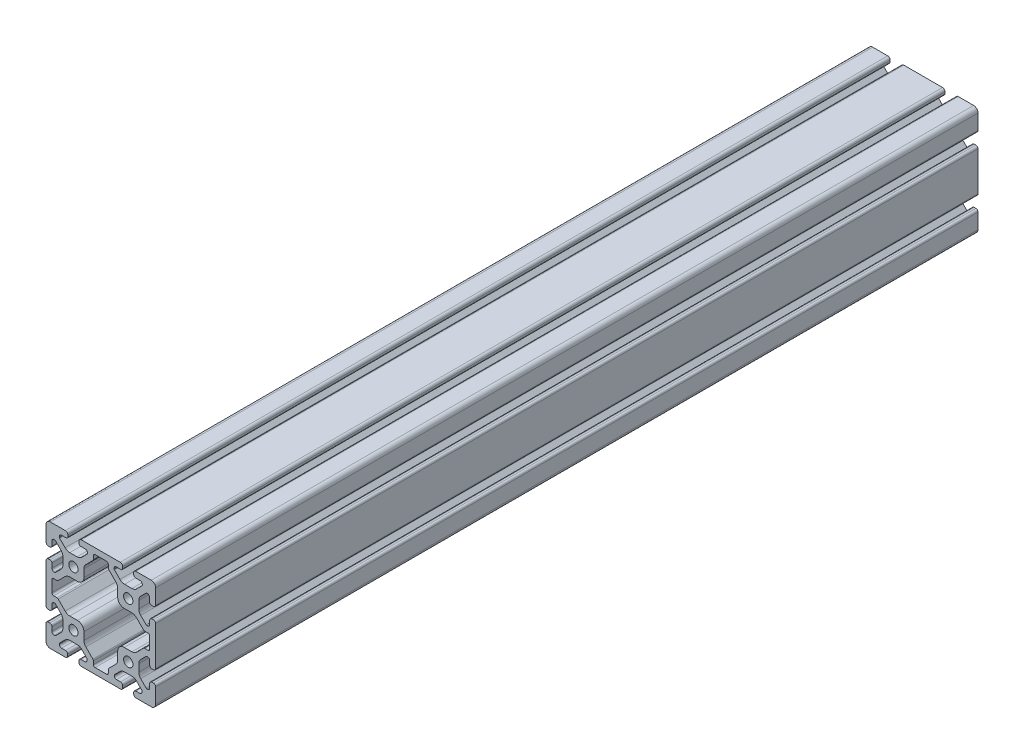
from build123d import *

# Parameters (mm, degrees)
SKETCH1_R                  = 3.4
EXTRUDE1_DEPTH             = 600
M8X1_25_TAPPED_HOLE4_D     = 6.8
M8X1_25_TAPPED_HOLE4_DEPTH = 9.75
M8X1_25_TAPPED_HOLE4_TIP   = 2.042926105
M8X1_25_TAPPED_HOLE3_D     = 6.8
M8X1_25_TAPPED_HOLE3_DEPTH = 31.65
M8X1_25_TAPPED_HOLE3_TIP   = 2.042926105


with BuildPart() as part:
    # Sketch1 → Extrude1 (new body)
    with BuildSketch(Plane.XY):
        with BuildLine():
            Line((29.091242789, 26.036541495), (33.082657296, 30.027956002))
            ThreePointArc((33.082657296, 30.027956002), (33.329219041, 30.192703293), (33.62005845, 30.250554848))
            Line((33.62005845, 30.250554848), (33.955571436, 30.250554848))
            ThreePointArc((33.955571436, 30.250554848), (35.065729082, 29.790712494), (35.525571436, 28.680554848))
            Line((35.525571436, 28.680554848), (35.525571436, 25.777866899))
            ThreePointArc((35.525571436, 25.777866899), (35.985413789, 24.667709253), (37.095571436, 24.207866899))
            Line((37.095571436, 24.207866899), (38.43, 24.207866899))
            ThreePointArc((38.43, 24.207866899), (39.540157646, 24.667709253), (40, 25.777866899))
            Line((40, 25.777866899), (40, 32.933852749))
            Line((40, 32.933852749), (40, 36.83))
            ThreePointArc((40, 36.83), (39.071528496, 39.071528496), (36.83, 40))
            Line((36.83, 40), (25.540851266, 40))
            ThreePointArc((25.540851266, 40), (24.43069362, 39.540157646), (23.970851266, 38.43))
            Line((23.970851266, 38.43), (23.970851266, 37.249043598))
            ThreePointArc((23.970851266, 37.249043598), (24.43069362, 36.138885952), (25.540851266, 35.679043598))
            Line((25.540851266, 35.679043598), (28.625762638, 35.679043598))
            ThreePointArc((28.625762638, 35.679043598), (29.77116849, 35.239363487), (30.250554848, 34.11))
            Line((30.250554848, 34.11), (30.250554848, 33.62005845))
            ThreePointArc((30.250554848, 33.62005845), (30.192703293, 33.329219041), (30.027956002, 33.082657296))
            Line((30.027956002, 33.082657296), (26.036541495, 29.091242789))
            ThreePointArc((26.036541495, 29.091242789), (24.495530588, 28.061572221), (22.677784284, 27.7))
            Line((22.677784284, 27.7), (17.322215716, 27.7))
            ThreePointArc((17.322215716, 27.7), (15.504469412, 28.061572221), (13.963458505, 29.091242789))
            Line((13.963458505, 29.091242789), (9.90393336, 33.150767934))
            ThreePointArc((9.90393336, 33.150767934), (9.764102181, 33.360040084), (9.715, 33.606893415))
            Line((9.715, 33.606893415), (9.715, 34.096834965))
            ThreePointArc((9.715, 34.096834965), (10.178698303, 35.216301697), (11.298165035, 35.68))
            Line((11.298165035, 35.68), (14.642754087, 35.68))
            ThreePointArc((14.642754087, 35.68), (15.560045469, 36.059954531), (15.94, 36.977245913))
            Line((15.94, 36.977245913), (15.94, 38.194841282))
            ThreePointArc((15.94, 38.194841282), (15.411281253, 39.471281253), (14.134841282, 40))
            Line((14.134841282, 40), (6.984433948, 40))
            Line((6.984433948, 40), (-6.984433948, 40))
            Line((-6.984433948, 40), (-14.134841282, 40))
            ThreePointArc((-14.134841282, 40), (-15.411281253, 39.471281253), (-15.94, 38.194841282))
            Line((-15.94, 38.194841282), (-15.94, 36.977245913))
            ThreePointArc((-15.94, 36.977245913), (-15.560045469, 36.059954531), (-14.642754087, 35.68))
            Line((-14.642754087, 35.68), (-11.298165035, 35.68))
            ThreePointArc((-11.298165035, 35.68), (-10.178698303, 35.216301697), (-9.715, 34.096834965))
            Line((-9.715, 34.096834965), (-9.715, 33.606893415))
            ThreePointArc((-9.715, 33.606893415), (-9.764102181, 33.360040084), (-9.90393336, 33.150767934))
            Line((-9.90393336, 33.150767934), (-13.963458505, 29.091242789))
            ThreePointArc((-13.963458505, 29.091242789), (-15.504469412, 28.061572221), (-17.322215716, 27.7))
            Line((-17.322215716, 27.7), (-22.677784284, 27.7))
            ThreePointArc((-22.677784284, 27.7), (-24.495530588, 28.061572221), (-26.036541495, 29.091242789))
            Line((-26.036541495, 29.091242789), (-30.09606664, 33.150767934))
            ThreePointArc((-30.09606664, 33.150767934), (-30.235897819, 33.360040084), (-30.285, 33.606893415))
            Line((-30.285, 33.606893415), (-30.285, 34.096834965))
            ThreePointArc((-30.285, 34.096834965), (-29.821301697, 35.216301697), (-28.701834965, 35.68))
            Line((-28.701834965, 35.68), (-25.357245913, 35.68))
            ThreePointArc((-25.357245913, 35.68), (-24.439954531, 36.059954531), (-24.06, 36.977245913))
            Line((-24.06, 36.977245913), (-24.06, 38.194841282))
            ThreePointArc((-24.06, 38.194841282), (-24.588718747, 39.471281253), (-25.865158718, 40))
            Line((-25.865158718, 40), (-33.031395847, 40))
            Line((-33.031395847, 40), (-36.83, 40))
            ThreePointArc((-36.83, 40), (-39.071528496, 39.071528496), (-40, 36.83))
            Line((-40, 36.83), (-40, 33.318079463))
            Line((-40, 33.318079463), (-40, 25.865158718))
            ThreePointArc((-40, 25.865158718), (-39.471281253, 24.588718747), (-38.194841282, 24.06))
            Line((-38.194841282, 24.06), (-36.977245913, 24.06))
            ThreePointArc((-36.977245913, 24.06), (-36.059954531, 24.439954531), (-35.68, 25.357245913))
            Line((-35.68, 25.357245913), (-35.68, 28.680554848))
            ThreePointArc((-35.68, 28.680554848), (-35.220157646, 29.790712494), (-34.11, 30.250554848))
            Line((-34.11, 30.250554848), (-33.62005845, 30.250554848))
            ThreePointArc((-33.62005845, 30.250554848), (-33.329219041, 30.192703293), (-33.082657296, 30.027956002))
            Line((-33.082657296, 30.027956002), (-29.091242789, 26.036541495))
            ThreePointArc((-29.091242789, 26.036541495), (-28.061572221, 24.495530588), (-27.7, 22.677784284))
            Line((-27.7, 22.677784284), (-27.7, 17.322215716))
            ThreePointArc((-27.7, 17.322215716), (-28.061572221, 15.504469412), (-29.091242789, 13.963458505))
            Line((-29.091242789, 13.963458505), (-33.082657296, 9.972043998))
            ThreePointArc((-33.082657296, 9.972043998), (-33.329219041, 9.807296707), (-33.62005845, 9.749445152))
            Line((-33.62005845, 9.749445152), (-34.11, 9.749445152))
            ThreePointArc((-34.11, 9.749445152), (-35.220157646, 10.209287506), (-35.68, 11.319445152))
            Line((-35.68, 11.319445152), (-35.68, 14.642754087))
            ThreePointArc((-35.68, 14.642754087), (-36.059954531, 15.560045469), (-36.977245913, 15.94))
            Line((-36.977245913, 15.94), (-38.194841282, 15.94))
            ThreePointArc((-38.194841282, 15.94), (-39.471281253, 15.411281253), (-40, 14.134841282))
            Line((-40, 14.134841282), (-40, 7.016888977))
            Line((-40, 7.016888977), (-40, -7.016888977))
            Line((-40, -7.016888977), (-40, -14.447338303))
            ThreePointArc((-40, -14.447338303), (-39.540157646, -15.557495949), (-38.43, -16.017338303))
            Line((-38.43, -16.017338303), (-37.25, -16.017338303))
            ThreePointArc((-37.25, -16.017338303), (-36.139842354, -15.557495949), (-35.68, -14.447338303))
            Line((-35.68, -14.447338303), (-35.68, -11.319445152))
            ThreePointArc((-35.68, -11.319445152), (-35.220157646, -10.209287506), (-34.11, -9.749445152))
            Line((-34.11, -9.749445152), (-33.62005845, -9.749445152))
            ThreePointArc((-33.62005845, -9.749445152), (-33.329219041, -9.807296707), (-33.082657296, -9.972043998))
            Line((-33.082657296, -9.972043998), (-29.091242789, -13.963458505))
            ThreePointArc((-29.091242789, -13.963458505), (-28.061572221, -15.504469412), (-27.7, -17.322215716))
            Line((-27.7, -17.322215716), (-27.7, -22.677784284))
            ThreePointArc((-27.7, -22.677784284), (-28.061572221, -24.495530588), (-29.091242789, -26.036541495))
            Line((-29.091242789, -26.036541495), (-32.871776968, -29.817075674))
            ThreePointArc((-32.871776968, -29.817075674), (-33.10612883, -29.976640176), (-33.382654504, -30.039211548))
            Line((-33.382654504, -30.039211548), (-34.05520779, -30.062697627))
            ThreePointArc((-34.05520779, -30.062697627), (-35.200613642, -29.623017515), (-35.68, -28.493654028))
            Line((-35.68, -28.493654028), (-35.68, -25.59096608))
            ThreePointArc((-35.68, -25.59096608), (-36.139842354, -24.480808433), (-37.25, -24.02096608))
            Line((-37.25, -24.02096608), (-38.43, -24.02096608))
            ThreePointArc((-38.43, -24.02096608), (-39.540157646, -24.480808433), (-40, -25.59096608))
            Line((-40, -25.59096608), (-40, -33.019082273))
            Line((-40, -33.019082273), (-40, -36.83))
            ThreePointArc((-40, -36.83), (-39.071528496, -39.071528496), (-36.83, -40))
            Line((-36.83, -40), (-33, -40))
            Line((-33, -40), (-25.72307469, -40))
            ThreePointArc((-25.72307469, -40), (-24.612917043, -39.540157646), (-24.15307469, -38.43))
            Line((-24.15307469, -38.43), (-24.15307469, -37.25))
            ThreePointArc((-24.15307469, -37.25), (-24.612917043, -36.139842354), (-25.72307469, -35.68))
            Line((-25.72307469, -35.68), (-28.680554848, -35.68))
            ThreePointArc((-28.680554848, -35.68), (-29.790712494, -35.220157646), (-30.250554848, -34.11))
            Line((-30.250554848, -34.11), (-30.250554848, -33.62005845))
            ThreePointArc((-30.250554848, -33.62005845), (-30.192703293, -33.329219041), (-30.027956002, -33.082657296))
            Line((-30.027956002, -33.082657296), (-26.036541495, -29.091242789))
            ThreePointArc((-26.036541495, -29.091242789), (-24.495530588, -28.061572221), (-22.677784284, -27.7))
            Line((-22.677784284, -27.7), (-17.322215716, -27.7))
            ThreePointArc((-17.322215716, -27.7), (-15.504469412, -28.061572221), (-13.963458505, -29.091242789))
            Line((-13.963458505, -29.091242789), (-10.203784275, -32.85091702))
            ThreePointArc((-10.203784275, -32.85091702), (-10.044219772, -33.085268882), (-9.9816484, -33.361794556))
            Line((-9.9816484, -33.361794556), (-9.957433876, -34.05520779))
            ThreePointArc((-9.957433876, -34.05520779), (-10.397113988, -35.200613642), (-11.526477474, -35.68))
            Line((-11.526477474, -35.68), (-14.429165423, -35.68))
            ThreePointArc((-14.429165423, -35.68), (-15.539323069, -36.139842354), (-15.999165423, -37.25))
            Line((-15.999165423, -37.25), (-15.999165423, -38.43))
            ThreePointArc((-15.999165423, -38.43), (-15.539323069, -39.540157646), (-14.429165423, -40))
            Line((-14.429165423, -40), (-6.998716097, -40))
            Line((-6.998716097, -40), (6.998716097, -40))
            Line((6.998716097, -40), (14.424638994, -40))
            ThreePointArc((14.424638994, -40), (15.53479664, -39.540157646), (15.994638994, -38.43))
            Line((15.994638994, -38.43), (15.994638994, -37.032644306))
            ThreePointArc((15.994638994, -37.032644306), (15.53479664, -35.922486659), (14.424638994, -35.462644306))
            Line((14.424638994, -35.462644306), (11.382372282, -35.462644306))
            ThreePointArc((11.382372282, -35.462644306), (10.272214636, -35.002801952), (9.812372282, -33.892644306))
            Line((9.812372282, -33.892644306), (9.812372282, -33.55713132))
            ThreePointArc((9.812372282, -33.55713132), (9.870223837, -33.266291912), (10.034971128, -33.019730166))
            Line((10.034971128, -33.019730166), (13.963458505, -29.091242789))
            ThreePointArc((13.963458505, -29.091242789), (15.504469412, -28.061572221), (17.322215716, -27.7))
            Line((17.322215716, -27.7), (22.677784284, -27.7))
            ThreePointArc((22.677784284, -27.7), (24.495530588, -28.061572221), (26.036541495, -29.091242789))
            Line((26.036541495, -29.091242789), (29.794925243, -32.849626538))
            ThreePointArc((29.794925243, -32.849626538), (29.954489746, -33.083978399), (30.017061118, -33.360504074))
            Line((30.017061118, -33.360504074), (30.041320706, -34.05520779))
            ThreePointArc((30.041320706, -34.05520779), (29.601640594, -35.200613642), (28.472277108, -35.68))
            Line((28.472277108, -35.68), (25.569589159, -35.68))
            ThreePointArc((25.569589159, -35.68), (24.459431513, -36.139842354), (23.999589159, -37.25))
            Line((23.999589159, -37.25), (23.999589159, -38.43))
            ThreePointArc((23.999589159, -38.43), (24.459431513, -39.540157646), (25.569589159, -40))
            Line((25.569589159, -40), (32.999849358, -40))
            Line((32.999849358, -40), (36.83, -40))
            ThreePointArc((36.83, -40), (39.071528496, -39.071528496), (40, -36.83))
            Line((40, -36.83), (40, -33.025941835))
            Line((40, -33.025941835), (40, -25.777866899))
            ThreePointArc((40, -25.777866899), (39.540157646, -24.667709253), (38.43, -24.207866899))
            Line((38.43, -24.207866899), (37.25, -24.207866899))
            ThreePointArc((37.25, -24.207866899), (36.139842354, -24.667709253), (35.68, -25.777866899))
            Line((35.68, -25.777866899), (35.68, -28.680554848))
            ThreePointArc((35.68, -28.680554848), (35.220157646, -29.790712494), (34.11, -30.250554848))
            Line((34.11, -30.250554848), (33.62005845, -30.250554848))
            ThreePointArc((33.62005845, -30.250554848), (33.329219041, -30.192703293), (33.082657296, -30.027956002))
            Line((33.082657296, -30.027956002), (29.091242789, -26.036541495))
            ThreePointArc((29.091242789, -26.036541495), (28.061572221, -24.495530588), (27.7, -22.677784284))
            Line((27.7, -22.677784284), (27.7, -17.322215716))
            ThreePointArc((27.7, -17.322215716), (28.061572221, -15.504469412), (29.091242789, -13.963458505))
            Line((29.091242789, -13.963458505), (33.082657296, -9.972043998))
            ThreePointArc((33.082657296, -9.972043998), (33.329219041, -9.807296707), (33.62005845, -9.749445152))
            Line((33.62005845, -9.749445152), (34.11, -9.749445152))
            ThreePointArc((34.11, -9.749445152), (35.220157646, -10.209287506), (35.68, -11.319445152))
            Line((35.68, -11.319445152), (35.68, -14.222133101))
            ThreePointArc((35.68, -14.222133101), (36.139842354, -15.332290747), (37.25, -15.792133101))
            Line((37.25, -15.792133101), (38.43, -15.792133101))
            ThreePointArc((38.43, -15.792133101), (39.540157646, -15.332290747), (40, -14.222133101))
            Line((40, -14.222133101), (40, -7.021415406))
            Line((40, -7.021415406), (40, 7.021415406))
            Line((40, 7.021415406), (40, 14.222133101))
            ThreePointArc((40, 14.222133101), (39.540157646, 15.332290747), (38.43, 15.792133101))
            Line((38.43, 15.792133101), (37.25, 15.792133101))
            ThreePointArc((37.25, 15.792133101), (36.139842354, 15.332290747), (35.68, 14.222133101))
            Line((35.68, 14.222133101), (35.68, 11.319445152))
            ThreePointArc((35.68, 11.319445152), (35.220157646, 10.209287506), (34.11, 9.749445152))
            Line((34.11, 9.749445152), (33.62005845, 9.749445152))
            ThreePointArc((33.62005845, 9.749445152), (33.329219041, 9.807296707), (33.082657296, 9.972043998))
            Line((33.082657296, 9.972043998), (29.091242789, 13.963458505))
            ThreePointArc((29.091242789, 13.963458505), (28.061572221, 15.504469412), (27.7, 17.322215716))
            Line((27.7, 17.322215716), (27.7, 22.677784284))
            ThreePointArc((27.7, 22.677784284), (28.061572221, 24.495530588), (29.091242789, 26.036541495))
        make_face()
        with Locations((-20, 20)):
            Circle(SKETCH1_R, mode=Mode.SUBTRACT)
        with Locations((20, 20)):
            Circle(SKETCH1_R, mode=Mode.SUBTRACT)
        with Locations((20, -20)):
            Circle(SKETCH1_R, mode=Mode.SUBTRACT)
        with Locations((-20, -20)):
            Circle(SKETCH1_R, mode=Mode.SUBTRACT)
        with BuildLine():
            Line((17.07, 12.32), (22.657784284, 12.32))
            ThreePointArc((22.657784284, 12.32), (24.475530588, 11.958427779), (26.016541495, 10.928757211))
            Line((26.016541495, 10.928757211), (31.143879165, 5.80141954))
            ThreePointArc((31.143879165, 5.80141954), (31.555896818, 5.526118146), (32.041904777, 5.429445152))
            Line((32.041904777, 5.429445152), (34.41, 5.429445152))
            ThreePointArc((34.41, 5.429445152), (35.308025612, 5.057470764), (35.68, 4.159445152))
            Line((35.68, 4.159445152), (35.68, -4.159445152))
            ThreePointArc((35.68, -4.159445152), (35.308025612, -5.057470764), (34.41, -5.429445152))
            Line((34.41, -5.429445152), (32.041904777, -5.429445152))
            ThreePointArc((32.041904777, -5.429445152), (31.555896818, -5.526118146), (31.143879165, -5.80141954))
            Line((31.143879165, -5.80141954), (26.016541495, -10.928757211))
            ThreePointArc((26.016541495, -10.928757211), (24.475530588, -11.958427779), (22.657784284, -12.32))
            Line((22.657784284, -12.32), (17.07, -12.32))
            ThreePointArc((17.07, -12.32), (13.711242789, -13.711242789), (12.32, -17.07))
            Line((12.32, -17.07), (12.32, -22.657784284))
            ThreePointArc((12.32, -22.657784284), (11.958427779, -24.475530588), (10.928757211, -26.016541495))
            Line((10.928757211, -26.016541495), (5.80141954, -31.143879165))
            ThreePointArc((5.80141954, -31.143879165), (5.526118146, -31.555896818), (5.429445152, -32.041904777))
            Line((5.429445152, -32.041904777), (5.429445152, -34.41))
            ThreePointArc((5.429445152, -34.41), (5.057470764, -35.308025612), (4.159445152, -35.68))
            Line((4.159445152, -35.68), (-4.159445152, -35.68))
            ThreePointArc((-4.159445152, -35.68), (-5.057470764, -35.308025612), (-5.429445152, -34.41))
            Line((-5.429445152, -34.41), (-5.429445152, -32.041904777))
            ThreePointArc((-5.429445152, -32.041904777), (-5.526118146, -31.555896818), (-5.80141954, -31.143879165))
            Line((-5.80141954, -31.143879165), (-10.928757211, -26.016541495))
            ThreePointArc((-10.928757211, -26.016541495), (-11.958427779, -24.475530588), (-12.32, -22.657784284))
            Line((-12.32, -22.657784284), (-12.32, -17.07))
            ThreePointArc((-12.32, -17.07), (-13.711242789, -13.711242789), (-17.07, -12.32))
            Line((-17.07, -12.32), (-22.657784284, -12.32))
            ThreePointArc((-22.657784284, -12.32), (-24.475530588, -11.958427779), (-26.016541495, -10.928757211))
            Line((-26.016541495, -10.928757211), (-31.143879165, -5.80141954))
            ThreePointArc((-31.143879165, -5.80141954), (-31.555896818, -5.526118146), (-32.041904777, -5.429445152))
            Line((-32.041904777, -5.429445152), (-34.41, -5.429445152))
            ThreePointArc((-34.41, -5.429445152), (-35.308025612, -5.057470764), (-35.68, -4.159445152))
            Line((-35.68, -4.159445152), (-35.68, 4.159445152))
            ThreePointArc((-35.68, 4.159445152), (-35.308025612, 5.057470764), (-34.41, 5.429445152))
            Line((-34.41, 5.429445152), (-32.041904777, 5.429445152))
            ThreePointArc((-32.041904777, 5.429445152), (-31.555896818, 5.526118146), (-31.143879165, 5.80141954))
            Line((-31.143879165, 5.80141954), (-26.016541495, 10.928757211))
            ThreePointArc((-26.016541495, 10.928757211), (-24.475530588, 11.958427779), (-22.657784284, 12.32))
            Line((-22.657784284, 12.32), (-17.07, 12.32))
            ThreePointArc((-17.07, 12.32), (-13.711242789, 13.711242789), (-12.32, 17.07))
            Line((-12.32, 17.07), (-12.32, 22.657784284))
            ThreePointArc((-12.32, 22.657784284), (-11.958427779, 24.475530588), (-10.928757211, 26.016541495))
            Line((-10.928757211, 26.016541495), (-5.80141954, 31.143879165))
            ThreePointArc((-5.80141954, 31.143879165), (-5.526118146, 31.555896818), (-5.429445152, 32.041904777))
            Line((-5.429445152, 32.041904777), (-5.429445152, 34.41))
            ThreePointArc((-5.429445152, 34.41), (-5.057470764, 35.308025612), (-4.159445152, 35.68))
            Line((-4.159445152, 35.68), (4.159445152, 35.68))
            ThreePointArc((4.159445152, 35.68), (5.057470764, 35.308025612), (5.429445152, 34.41))
            Line((5.429445152, 34.41), (5.429445152, 32.041904777))
            ThreePointArc((5.429445152, 32.041904777), (5.526118146, 31.555896818), (5.80141954, 31.143879165))
            Line((5.80141954, 31.143879165), (10.928757211, 26.016541495))
            ThreePointArc((10.928757211, 26.016541495), (11.958427779, 24.475530588), (12.32, 22.657784284))
            Line((12.32, 22.657784284), (12.32, 17.07))
            ThreePointArc((12.32, 17.07), (13.711242789, 13.711242789), (17.07, 12.32))
        make_face(mode=Mode.SUBTRACT)
    extrude(amount=-EXTRUDE1_DEPTH)

    # M8x1.25 Tapped Hole4
    with Locations(Plane.XY):
        with Locations((-20, 20), (20, 20), (20, -20), (-20, -20)):
            Hole(M8X1_25_TAPPED_HOLE4_D / 2, depth=M8X1_25_TAPPED_HOLE4_DEPTH)
            with Locations((0, 0, -(M8X1_25_TAPPED_HOLE4_DEPTH + M8X1_25_TAPPED_HOLE4_TIP / 2))):  # 118° drill point
                Cone(0, M8X1_25_TAPPED_HOLE4_D / 2, M8X1_25_TAPPED_HOLE4_TIP, mode=Mode.SUBTRACT)

    # M8x1.25 Tapped Hole3
    with Locations(Plane(origin=(0, 0, -600), x_dir=(-1, 0, 0), z_dir=(0, 0, -1))):
        with Locations((-20, 20), (20, 20), (20, -20), (-20, -20)):
            Hole(M8X1_25_TAPPED_HOLE3_D / 2, depth=M8X1_25_TAPPED_HOLE3_DEPTH)
            with Locations((0, 0, -(M8X1_25_TAPPED_HOLE3_DEPTH + M8X1_25_TAPPED_HOLE3_TIP / 2))):  # 118° drill point
                Cone(0, M8X1_25_TAPPED_HOLE3_D / 2, M8X1_25_TAPPED_HOLE3_TIP, mode=Mode.SUBTRACT)


solid = part.part
